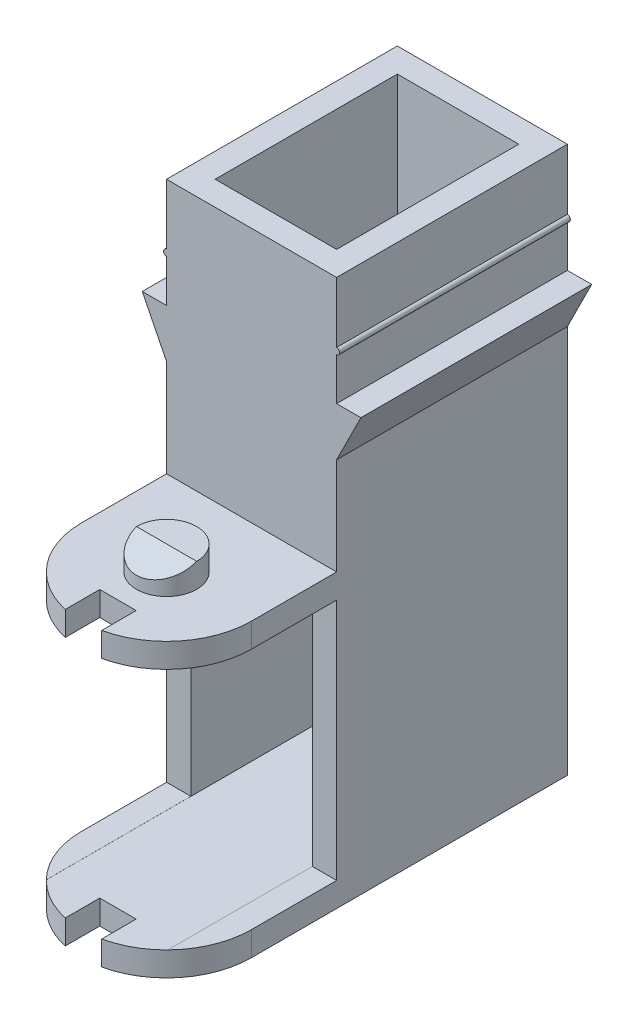
from build123d import *

# Parameters (mm, degrees)
EXTRUDE_1_DEPTH     = 19
CUT_EXTRUDE_2_DEPTH = 43
CUT_EXTRUDE_3_DEPTH = 2
EXTRUDE_2_DEPTH     = 14
SKETCH_5_R          = 2.48
EXTRUDE_3_DEPTH     = 2
CUT_EXTRUDE_4_DEPTH = 50
EXTRUDE_START       = 2
SKETCH_7_R          = 2.48
EXTRUDE_4_DEPTH     = 2
SKETCH_8_W          = 1.371307674
SKETCH_8_H          = 2.48
EXTRUDE_5_DEPTH     = 2
CUT_EXTRUDE_5_DEPTH = 10
CUT_EXTRUDE_6_DEPTH = 2
SKETCH_11_W         = 2.08463024
SKETCH_11_H         = 2.48
EXTRUDE_7_DEPTH     = 2
CUT_EXTRUDE_7_DEPTH = 20
CUT_EXTRUDE_8_DEPTH = 2.5
CUT_EXTRUDE_9_DEPTH = 50


with BuildPart() as part:
    # 草图1 → 凸台-拉伸1 (new body)
    with BuildSketch(Plane.XY):
        with BuildLine():
            Line((0, 0), (7, 0))
            Line((7, 0), (7, -5))
            ThreePointArc((7, -5), (7.25, -5.25), (7, -5.5))
            Line((7, -5.5), (7, -9))
            Line((7, -9), (9, -9))
            Line((9, -9), (7, -13))
            Line((7, -13), (7, -45))
            Line((7, -45), (0, -45))
            Line((0, -45), (-7, -45))
            Line((-7, -45), (-7, -13))
            Line((-7, -13), (-9, -9))
            Line((-9, -9), (-7, -9))
            Line((-7, -9), (-7, -5.5))
            ThreePointArc((-7, -5.5), (-7.25, -5.25), (-7, -5))
            Line((-7, -5), (-7, 0))
            Line((-7, 0), (0, 0))
        make_face()
    extrude(amount=EXTRUDE_1_DEPTH)

    # 草图2 → 切除-拉伸2 (cut)
    with BuildSketch(Plane(origin=(0, 0, 0), x_dir=(1, 0, 0), z_dir=(0, 1, 0))):
        Polygon((0, -2), (5, -2), (5, -9.5), (5, -17), (0, -17), (-5, -17), (-5, -9.5), (-5, -2), align=None)
    extrude(amount=-CUT_EXTRUDE_2_DEPTH, mode=Mode.SUBTRACT)

    # 草图3 → 切除-拉伸3 (cut)
    with BuildSketch(Plane.XY.offset(19)):
        Polygon((0, -23), (5, -23), (5, -43), (0, -43), (-5, -43), (-5, -23), align=None)
    extrude(amount=-CUT_EXTRUDE_3_DEPTH, mode=Mode.SUBTRACT)

    # 草图4 → 凸台-拉伸2 (add)
    with BuildSketch(Plane.XY.offset(19)):
        Polygon((-7, -42.996240591), (-7, -45), (7, -45), (7, -42.996240591), (5, -42.996240591), (5, -43), (-5, -43), (-5, -42.996240591), align=None)
        Polygon((-7, -23), (5, -23), (7, -23), (7, -21), (-7, -21), align=None)
    extrude(amount=EXTRUDE_2_DEPTH)

    # 草图5 → 凸台-拉伸3 (add)
    with BuildSketch(Plane.XZ.offset(45)):
        with Locations(Location((0, 26, 0), (0, 0, 270))):
            Circle(SKETCH_5_R)
    extrude(amount=EXTRUDE_3_DEPTH)

    # 草图6 → 切除-拉伸4 (cut)
    with BuildSketch(Plane(origin=(0, -45, 0), x_dir=(-1, 0, 0), z_dir=(0, -1, 0))):
        with BuildLine():
            Line((7, -33), (7, -26))
            ThreePointArc((7, -26), (4.949747468, -30.949747468), (0, -33))
            Line((0, -33), (7, -33))
        make_face()
        with BuildLine():
            Line((-7, -33), (0, -33))
            ThreePointArc((0, -33), (-4.949747468, -30.949747468), (-7, -26))
            Line((-7, -26), (-7, -33))
        make_face()
    extrude(amount=-CUT_EXTRUDE_4_DEPTH, mode=Mode.SUBTRACT)

    # 草图7 → 凸台-拉伸4 (add)
    with BuildSketch(Plane(origin=(0, -21, 0), x_dir=(1, 0, 0), z_dir=(0, 1, 0)).offset(EXTRUDE_START)):
        with Locations(Location((0, -26, 0), (0, 0, 90))):
            Circle(SKETCH_7_R)
    extrude(amount=-EXTRUDE_4_DEPTH)

    # 草图8 → 凸台-拉伸5 (add)
    with BuildSketch(Plane(origin=(0, -21, 0), x_dir=(1, 0, 0), z_dir=(0, 1, 0))):
        with Locations((4.228560023, -27.24)):
            Rectangle(SKETCH_8_W, SKETCH_8_H)
    extrude(amount=EXTRUDE_5_DEPTH)

    # 草图9 → 切除-拉伸5 (cut)
    with BuildSketch(Plane(origin=(4.91421386, 0, 0), x_dir=(0, 0, -1), z_dir=(1, 0, 0))):
        Polygon((-26, -19), (-28.48, -19), (-28.48, -20), align=None)
    extrude(amount=-CUT_EXTRUDE_5_DEPTH, mode=Mode.SUBTRACT)

    # 草图10 → 切除-拉伸6 (cut)
    with BuildSketch(Plane(origin=(4.91421386, 0, 0), x_dir=(0, 0, -1), z_dir=(1, 0, 0))):
        Polygon((-26, -19), (-26, -21), (-28.48, -21), (-28.48, -20), align=None)
    extrude(amount=-CUT_EXTRUDE_6_DEPTH, mode=Mode.SUBTRACT)

    # 草图11 → 凸台-拉伸7 (add)
    with BuildSketch(Plane(origin=(0, -47, 0), x_dir=(-1, 0, 0), z_dir=(0, -1, 0))):
        with Locations((-4.196152556, -27.25184449)):
            Rectangle(SKETCH_11_W, SKETCH_11_H)
    extrude(amount=-EXTRUDE_7_DEPTH)

    # 草图12 → 切除-拉伸7 (cut)
    with BuildSketch(Plane(origin=(5.238467676, 0, 0), x_dir=(0, 0, -1), z_dir=(1, 0, 0))):
        Polygon((-28.49184449, -47), (-28.49184449, -46), (-26.01184449, -47), align=None)
    extrude(amount=-CUT_EXTRUDE_7_DEPTH, mode=Mode.SUBTRACT)

    # 草图13 → 切除-拉伸8 (cut)
    with BuildSketch(Plane(origin=(5.238467676, 0, 0), x_dir=(0, 0, -1), z_dir=(1, 0, 0))):
        Polygon((-28.49184449, -46), (-26.01184449, -47), (-26, -45), (-28.49184449, -45), align=None)
    extrude(amount=-CUT_EXTRUDE_8_DEPTH, mode=Mode.SUBTRACT)

    # 草图14 → 切除-拉伸9 (cut)
    with BuildSketch(Plane.XZ.offset(45)):
        with BuildLine():
            ThreePointArc((1.5, 32.837397166), (0.754393744, 32.959230567), (0, 33))
            Line((0, 33), (0, 30))
            Line((0, 30), (1.5, 30))
            Line((1.5, 30), (1.5, 32.837397166))
        make_face()
        with BuildLine():
            Line((0, 30), (0, 33))
            ThreePointArc((0, 33), (-0.754393744, 32.959230567), (-1.5, 32.837397166))
            Line((-1.5, 32.837397166), (-1.5, 30))
            Line((-1.5, 30), (0, 30))
        make_face()
        with BuildLine():
            ThreePointArc((-1.5, 32.837397166), (-0.754393744, 32.959230567), (0, 33))
            ThreePointArc((0, 33), (0.754393744, 32.959230567), (1.5, 32.837397166))
            Line((1.5, 32.837397166), (1.5, 33.175350271))
            Line((1.5, 33.175350271), (-1.5, 33.175350271))
            Line((-1.5, 33.175350271), (-1.5, 32.837397166))
        make_face()
    extrude(amount=-CUT_EXTRUDE_9_DEPTH, mode=Mode.SUBTRACT)


solid = part.part
